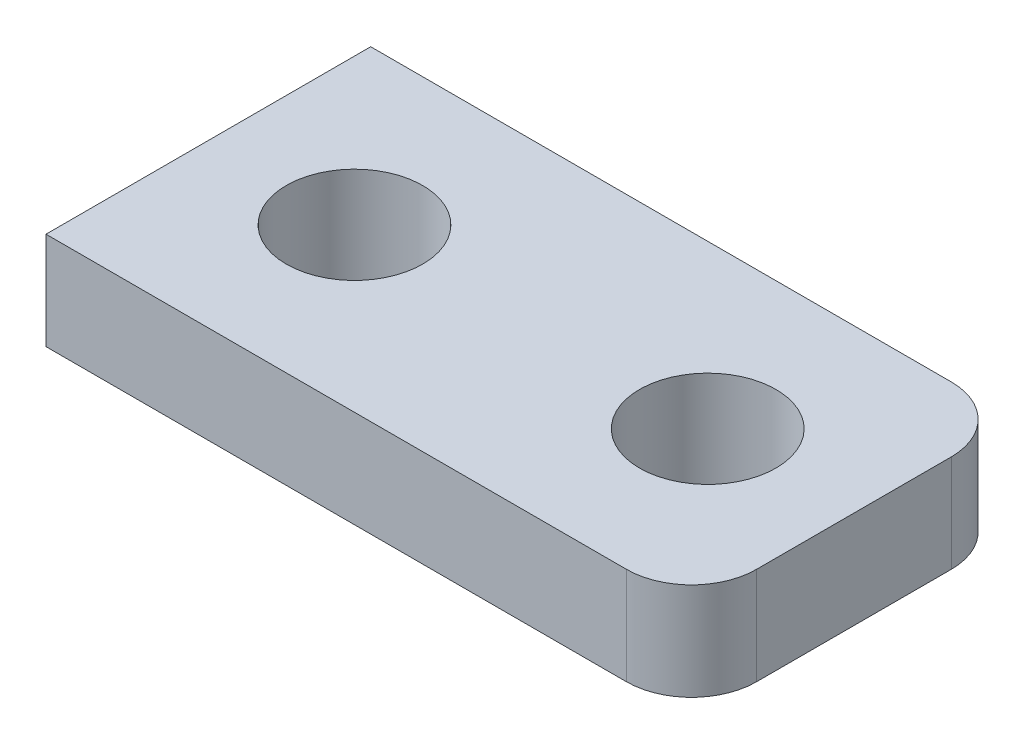
from build123d import *

# Parameters (mm, degrees)
SKETCH1_W           = 19.88
SKETCH1_H           = 10
BOSS_EXTRUDE1_DEPTH = 3
FILLET1_R           = 2
SKETCH2_R           = 2.1
CUT_EXTRUDE1_DEPTH  = 3


with BuildPart() as part:
    # Sketch1 → Boss-Extrude1 (new body)
    with BuildSketch(Plane(origin=(0, 0, 0), x_dir=(1, 0, 0), z_dir=(0, 1, 0))):
        with Locations((9.94, 5)):
            Rectangle(SKETCH1_W, SKETCH1_H)
    extrude(amount=BOSS_EXTRUDE1_DEPTH)

    # Fillet1
    fillet1_edges = [part.edges().sort_by_distance(p)[0] for p in [
        (19.88, 1.5, -10),
        (19.88, 1.5, 0),
    ]]
    fillet(fillet1_edges, radius=FILLET1_R)

    # Sketch2 → Cut-Extrude1 (cut)
    with BuildSketch(Plane(origin=(0, 3, 0), x_dir=(1, 0, 0), z_dir=(0, 1, 0))):
        with Locations(Location((4.5, 5, 0), (0, 0, 270))):
            Circle(SKETCH2_R)
        with Locations(Location((15.38, 5, 0), (0, 0, 270))):
            Circle(SKETCH2_R)
    extrude(amount=-CUT_EXTRUDE1_DEPTH, mode=Mode.SUBTRACT)


solid = part.part
